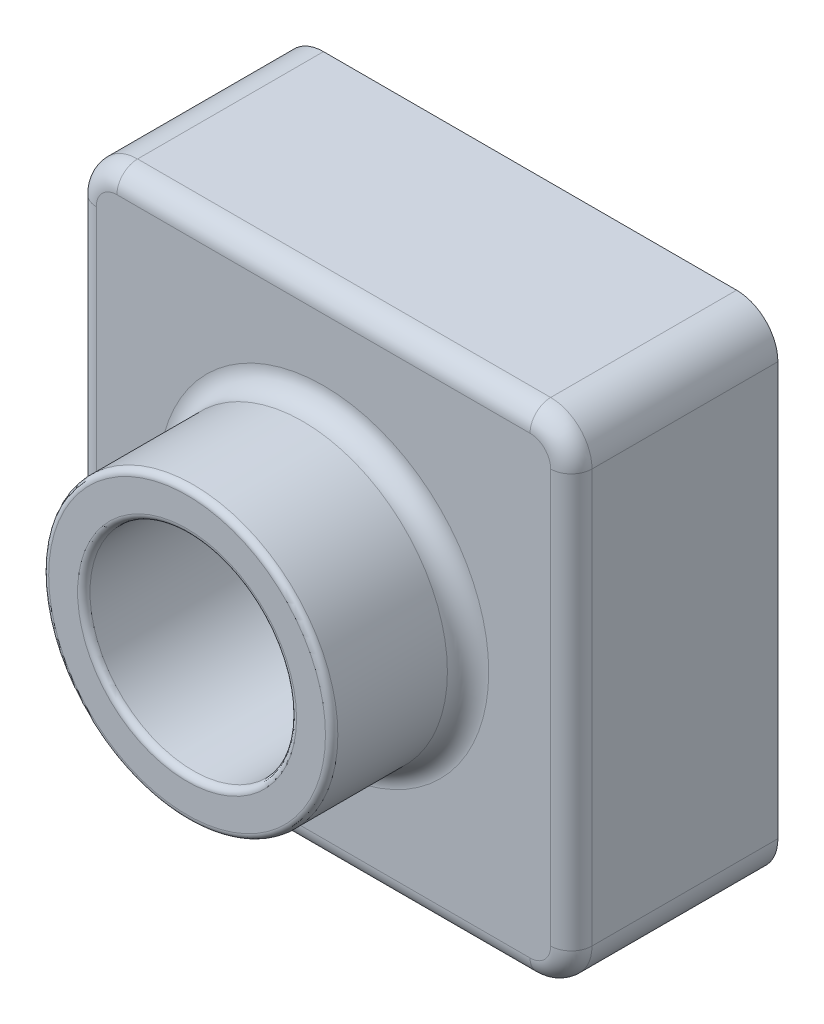
from build123d import *

# Parameters (mm, degrees)
SKETCH1_W           = 120
SKETCH1_H           = 120
BOSS_EXTRUDE1_DEPTH = 50
SKETCH2_R           = 35
BOSS_EXTRUDE2_DEPTH = 33.02
SKETCH3_R           = 25
CUT_EXTRUDE1_DEPTH  = 189.924112807
FILLET1_R           = 10
FILLET2_R           = 1.5
FILLET3_R           = 5
SHELL1_T            = -2


with BuildPart() as part:
    # Sketch1 → Boss-Extrude1 (new body)
    with BuildSketch(Plane.XY):
        with Locations((60, 60)):
            Rectangle(SKETCH1_W, SKETCH1_H)
    extrude(amount=BOSS_EXTRUDE1_DEPTH)

    # Sketch2 → Boss-Extrude2 (add)
    with BuildSketch(Plane.XY.offset(50)):
        with Locations(Location((60, 60, 0), (0, 0, 180))):
            Circle(SKETCH2_R)
    extrude(amount=BOSS_EXTRUDE2_DEPTH)

    # Sketch3 → Cut-Extrude1 (cut, through all)
    with BuildSketch(Plane.XY.offset(83.02)):
        with Locations((60, 60)):
            Circle(SKETCH3_R)
    extrude(amount=-CUT_EXTRUDE1_DEPTH, mode=Mode.SUBTRACT)

    # Fillet1
    fillet1_edges = [part.edges().sort_by_distance(p)[0] for p in [
        (0, 120, 25),
        (120, 120, 25),
        (120, 0, 25),
        (0, 0, 25),
    ]]
    fillet(fillet1_edges, radius=FILLET1_R)

    # Fillet2
    fillet2_edges = [part.edges().sort_by_distance(p)[0] for p in [
        (95, 60, 83.02),
        (35, 60, 83.02),
    ]]
    fillet(fillet2_edges, radius=FILLET2_R)

    # Fillet3
    fillet3_edges = [part.edges().sort_by_distance(p)[0] for p in [
        (95, 60, 50),
        (60, 0, 50),
        (0, 60, 50),
        (120, 60, 50),
        (60, 120, 50),
        (117.071067812, 2.928932188, 50),
        (117.071067812, 117.071067812, 50),
        (2.928932188, 117.071067812, 50),
        (2.928932188, 2.928932188, 50),
    ]]
    fillet(fillet3_edges, radius=FILLET3_R)

    # Shell1
    shell1_openings = [part.faces().sort_by_distance(p)[0] for p in [
        (60, 1.697056275, 0),
    ]]
    offset(amount=SHELL1_T, openings=shell1_openings, kind=Kind.INTERSECTION)


solid = part.part
